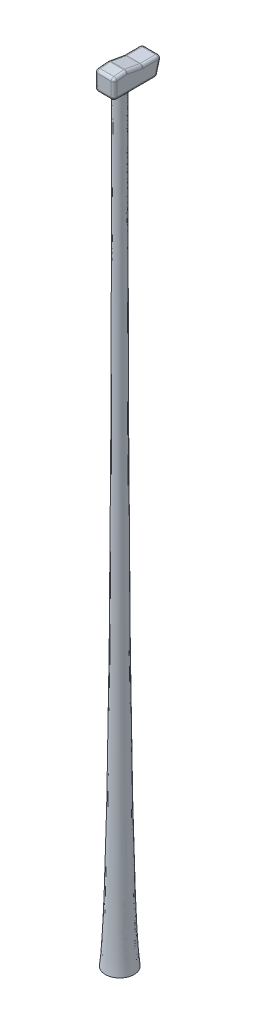
from build123d import *

# Parameters (mm, degrees)
AUFSATZ_LINEAR_AUSTRAGEN1_DEPTH      = 1000
AUFSATZ_LINEAR_AUSTRAGEN1_DEPTH_BACK = 1000
VERRUNDUNG1_R                        = 300


with BuildPart() as part:
    # Skizze2 → Aufsatz-Linear austragen1 (new, two sides: drawn at the far end of the back side and taken through both)
    with BuildSketch(Plane(origin=(0, 0, 0), x_dir=(0, 0, -1), z_dir=(1, 0, 0)).offset(-AUFSATZ_LINEAR_AUSTRAGEN1_DEPTH_BACK)):
        Polygon((500, -1000), (500, 1000), (1850, 1118.10969576), (3500, 827.170177591), (5500, 827.170177591), (5010.41122648, -1000), align=None)
    extrude(amount=AUFSATZ_LINEAR_AUSTRAGEN1_DEPTH + AUFSATZ_LINEAR_AUSTRAGEN1_DEPTH_BACK)

    # Verrundung1
    verrundung1_edges = [part.edges().sort_by_distance(p)[0] for p in [
        (0, -1000, -5010.41122648),
        (-1000, -86.414911204, -5255.20561324),
        (-1000, -1000, -2755.20561324),
        (-1000, 0, -500),
        (0, -1000, -500),
        (1000, 0, -500),
        (1000, -86.414911204, -5255.20561324),
        (1000, -1000, -2755.20561324),
        (-1000, 827.170177591, -4500),
        (0, 827.170177591, -5500),
        (1000, 827.170177591, -4500),
        (-1000, 972.639936676, -2675),
        (0, 827.170177591, -3500),
        (1000, 972.639936676, -2675),
        (-1000, 1059.05484788, -1175),
        (0, 1118.10969576, -1850),
        (1000, 1059.05484788, -1175),
        (0, 1000, -500),
    ]]
    fillet(verrundung1_edges, radius=VERRUNDUNG1_R)

    # Skizze3 → Rotation1 (revolve)
    with BuildSketch(Plane(origin=(0, 0, 0), x_dir=(0, 0, -1), z_dir=(1, 0, 0))):
        with BuildLine():
            Line((2100, -700), (1400, -700))
            Line((1400, -700), (1400, -1200))
            Line((1400, -1200), (1450, -1200))
            Line((1450, -1200), (1450, -1000))
            Line((1450, -1000), (1480, -1000))
            Line((1480, -1000), (1480, -1200))
            add(Edge.make_bspline(
                [(1480, -1200), (1480, -1555.39669448), (1606.342524753, -71467.212413931), (600, -80000)],
                knots=[0, 0, 0, 0, 1, 1, 1, 1], degree=3))
            Line((600, -80000), (2100, -80000))
            Line((2100, -80000), (2100, -700))
        make_face()
    revolve(axis=Axis((0, 0, -2100), (0, -1, 0)))


solid = part.part
